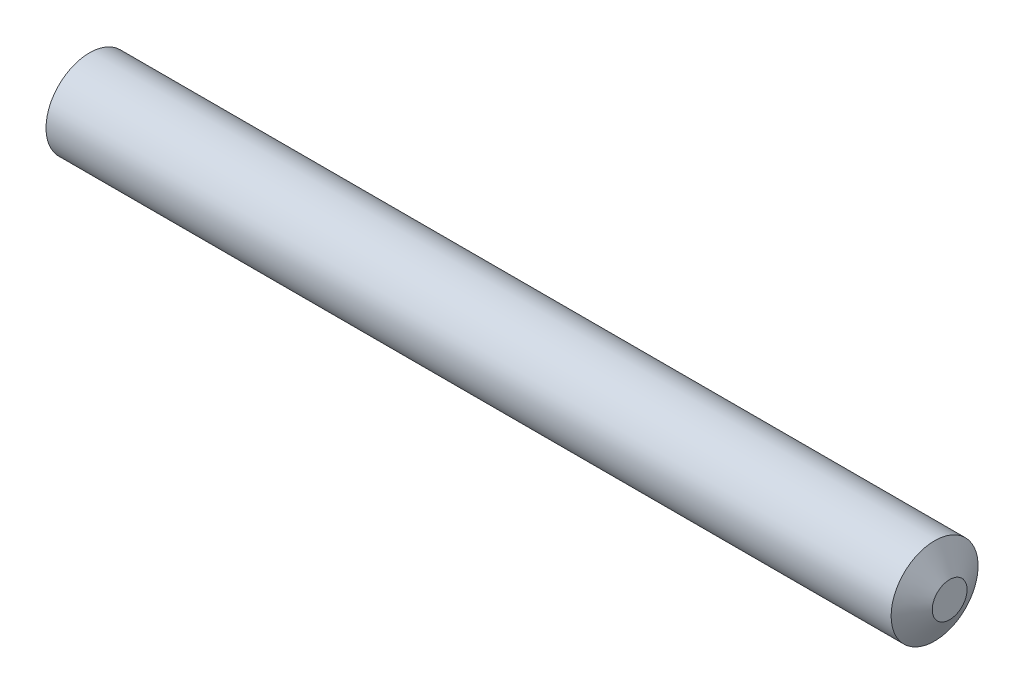
from build123d import *

# Parameters (mm, degrees)
HEX_2_DEPTH = 0.6


with BuildPart() as part:
    # BodySke → BaseBody (revolve)
    with BuildSketch(Plane.XY, mode=Mode.PRIVATE) as basebody_sk:
        Polygon((0, 0), (0, 0.774), (0.274818728, 1.25), (24.566987298, 1.25), (25, 0.5), (25, 0), align=None)
    revolve(basebody_sk.sketch.rotate(Axis((-12.7, 0, 0), (1, 0, 0)), 90), axis=Axis((-12.7, 0, 0), (1, 0, 0)))

    # Sketch2 → Hex 2 (cut)
    with BuildSketch(Plane.ZY):
        Polygon((0.259807621, 0.45), (-0.259807621, 0.45), (-0.519615242, 0), (-0.259807621, -0.45), (0.259807621, -0.45), (0.519615242, 0), align=None)
    extrude(amount=-HEX_2_DEPTH, mode=Mode.SUBTRACT)


solid = part.part
